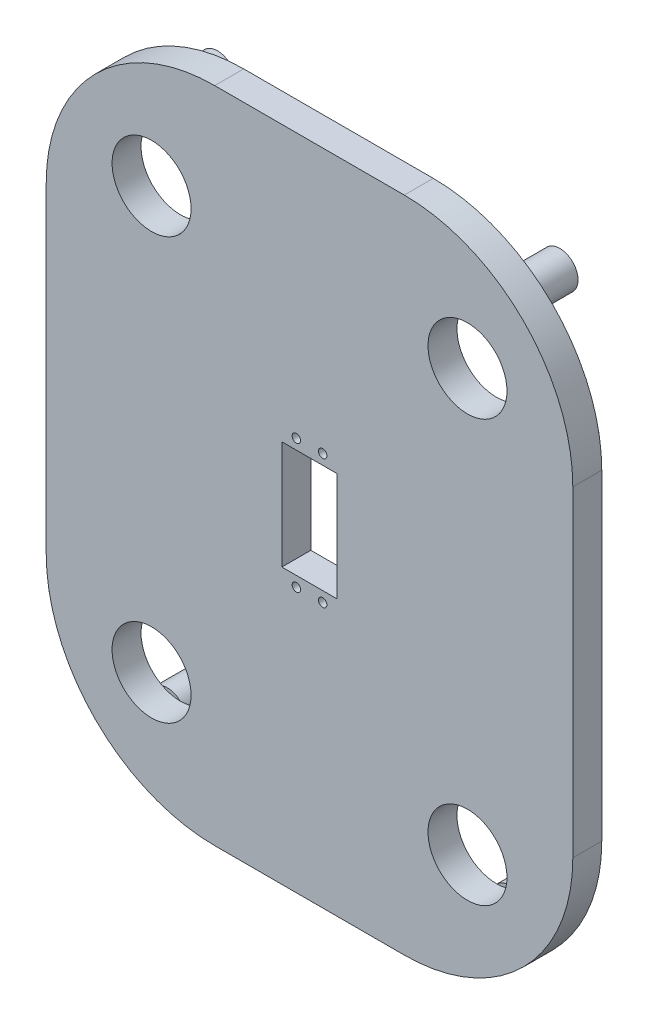
from build123d import *

# Parameters (mm, degrees)
SKETCH1_R           = 1.6
SKETCH1_W           = 21
SKETCH1_H           = 41
BOSS_EXTRUDE1_DEPTH = 11
SKETCH6_W           = 21
SKETCH6_H           = 0.1
CUT_EXTRUDE1_DEPTH  = 91.428148273
SKETCH7_W           = 21
SKETCH7_H           = 41.2
SKETCH7_R           = 1.6
CUT_EXTRUDE2_DEPTH  = 11
BOSS_EXTRUDE2_START = -11
SKETCH8_W           = 200
SKETCH8_H           = 250
SKETCH8_W_2         = 21
SKETCH8_H_2         = 41.2
SKETCH8_R           = 1.6
BOSS_EXTRUDE2_DEPTH = 11
FILLET1_R           = 64
FILLET2_R           = 64
FILLET3_R           = 64
FILLET4_R           = 64
SKETCH12_R          = 6.933523759
BOSS_EXTRUDE3_DEPTH = 19.05
SKETCH13_R          = 15
CUT_EXTRUDE3_DEPTH  = 11


with BuildPart() as part:
    # Sketch1 → Boss-Extrude1 (new body)
    with BuildSketch(Plane.XY):
        with BuildLine():
            Line((-20, 70), (-20, -50))
            ThreePointArc((-20, -50), (-2.5, -67.5), (15, -50))
            Line((15, -50), (15, 70))
            ThreePointArc((15, 70), (-2.5, 87.5), (-20, 70))
        make_face()
        with Locations((-7.5, 79.5)):
            Circle(SKETCH1_R, mode=Mode.SUBTRACT)
        with Locations(Location((2.5, 79.5, 0), (0, 0, 180))):
            Circle(SKETCH1_R, mode=Mode.SUBTRACT)
        with Locations((2.5, 30.5)):
            Circle(SKETCH1_R, mode=Mode.SUBTRACT)
        with Locations(Location((-7.5, 30.5, 0), (0, 0, 180))):
            Circle(SKETCH1_R, mode=Mode.SUBTRACT)
        with Locations((-2.5, 55)):
            Rectangle(SKETCH1_W, SKETCH1_H, mode=Mode.SUBTRACT)
    extrude(amount=BOSS_EXTRUDE1_DEPTH)

    # Sketch6 → Cut-Extrude1 (cut, through all)
    with BuildSketch(Plane.XY.offset(11)):
        with Locations((-2.5, 75.55)):
            Rectangle(SKETCH6_W, SKETCH6_H)
        with Locations((-2.5, 34.45)):
            Rectangle(SKETCH6_W, SKETCH6_H)
    extrude(amount=-CUT_EXTRUDE1_DEPTH, mode=Mode.SUBTRACT)

    # Sketch7 → Cut-Extrude2 (cut)
    with BuildSketch(Plane(origin=(0, 0, 0), x_dir=(-1, 0, 0), z_dir=(0, 0, -1))):
        with Locations((2.5, -35)):
            Rectangle(SKETCH7_W, SKETCH7_H)
        with Locations((-2.5, -10.5)):
            Circle(SKETCH7_R)
        with Locations((7.5, -10.5)):
            Circle(SKETCH7_R)
        with Locations((-2.5, -59.5)):
            Circle(SKETCH7_R)
        with Locations((7.5, -59.5)):
            Circle(SKETCH7_R)
    extrude(amount=-CUT_EXTRUDE2_DEPTH, mode=Mode.SUBTRACT)

    # Sketch8 → Boss-Extrude2 (add)
    # profile 1 of 6: a face of its own
    with BuildSketch(Plane.XY.offset(11).offset(BOSS_EXTRUDE2_START)):
        with Locations((-2.5, 55)):
            Rectangle(SKETCH8_W, SKETCH8_H)
        with BuildLine():
            ThreePointArc((-20, -50), (-2.5, -67.5), (15, -50))
            Line((15, -50), (15, 70))
            ThreePointArc((15, 70), (-2.5, 87.5), (-20, 70))
            Line((-20, 70), (-20, -50))
        make_face(mode=Mode.SUBTRACT)
    # profile 2 of 6: a face of its own
    with BuildSketch(Plane.XY.offset(11).offset(BOSS_EXTRUDE2_START)):
        with Locations((-2.5, -35)):
            Rectangle(SKETCH8_W_2, SKETCH8_H_2)
    # profile 3 of 6: a face of its own
    with BuildSketch(Plane.XY.offset(11).offset(BOSS_EXTRUDE2_START)):
        with Locations((-7.5, -59.5)):
            Circle(SKETCH8_R)
    # profile 4 of 6: a face of its own
    with BuildSketch(Plane.XY.offset(11).offset(BOSS_EXTRUDE2_START)):
        with Locations((2.5, -59.5)):
            Circle(SKETCH8_R)
    # profile 5 of 6: a face of its own
    with BuildSketch(Plane.XY.offset(11).offset(BOSS_EXTRUDE2_START)):
        with Locations((-7.5, -10.5)):
            Circle(SKETCH8_R)
    # profile 6 of 6: a face of its own
    with BuildSketch(Plane.XY.offset(11).offset(BOSS_EXTRUDE2_START)):
        with Locations((2.5, -10.5)):
            Circle(SKETCH8_R)
    extrude(amount=BOSS_EXTRUDE2_DEPTH)

    # Fillet1
    fillet1_edges = [part.edges().sort_by_distance(p)[0] for p in [
        (-102.5, 180, 5.5),
    ]]
    fillet(fillet1_edges, radius=FILLET1_R)

    # Fillet2
    fillet2_edges = [part.edges().sort_by_distance(p)[0] for p in [
        (97.5, 180, 5.5),
    ]]
    fillet(fillet2_edges, radius=FILLET2_R)

    # Fillet3
    fillet3_edges = [part.edges().sort_by_distance(p)[0] for p in [
        (97.5, -70, 5.5),
    ]]
    fillet(fillet3_edges, radius=FILLET3_R)

    # Fillet4
    fillet4_edges = [part.edges().sort_by_distance(p)[0] for p in [
        (-102.5, -70, 5.5),
    ]]
    fillet(fillet4_edges, radius=FILLET4_R)

    # Sketch12 → Boss-Extrude3 (add)
    with BuildSketch(Plane(origin=(0, 0, 0), x_dir=(-1, 0, 0), z_dir=(0, 0, -1))):
        with Locations(Location((67.5, 155, 0), (0, 0, 180))):
            Circle(SKETCH12_R)
        with Locations(Location((-62.5, -45, 0), (0, 0, 180))):
            Circle(SKETCH12_R)
        with Locations(Location((67.5, -45, 0), (0, 0, 180))):
            Circle(SKETCH12_R)
        with Locations(Location((-62.5, 155, 0), (0, 0, 180))):
            Circle(SKETCH12_R)
    extrude(amount=BOSS_EXTRUDE3_DEPTH)

    # Sketch13 → Cut-Extrude3 (cut)
    with BuildSketch(Plane.XY.offset(11)):
        with Locations((-62.5, 135)):
            Circle(SKETCH13_R)
        with Locations((57.5, 135)):
            Circle(SKETCH13_R)
        with Locations((57.5, -25)):
            Circle(SKETCH13_R)
        with Locations((-62.5, -25)):
            Circle(SKETCH13_R)
    extrude(amount=-CUT_EXTRUDE3_DEPTH, mode=Mode.SUBTRACT)


solid = part.part
